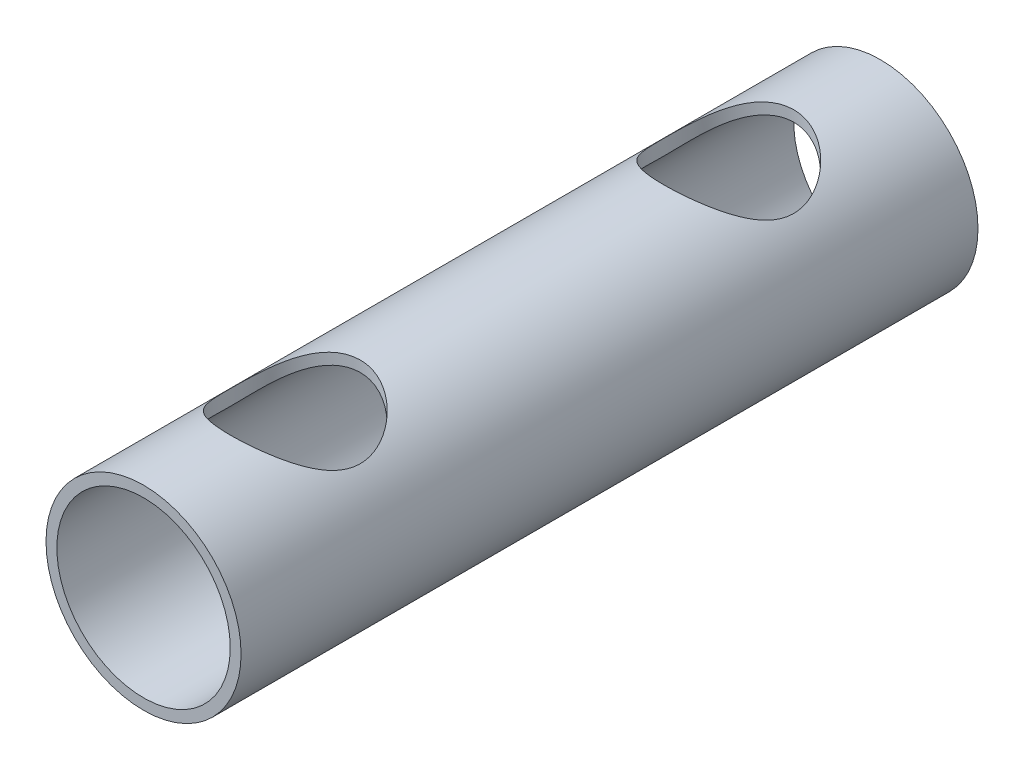
from build123d import *

# Parameters (mm, degrees)
SKETCH1_R           = 57.15
SKETCH1_R_2         = 50.8
BOSS_EXTRUDE1_DEPTH = 431.8
SKETCH2_R           = 38.1
CUT_EXTRUDE4_DEPTH  = 914.4


with BuildPart() as part:
    # Sketch1 → Boss-Extrude1 (new body)
    with BuildSketch(Plane.XY):
        Circle(SKETCH1_R)
        Circle(SKETCH1_R_2, mode=Mode.SUBTRACT)
    extrude(amount=BOSS_EXTRUDE1_DEPTH)

    # Sketch2 → Cut-Extrude4 (cut)
    with BuildSketch(Plane(origin=(0, 0, 0), x_dir=(1, 0, 0), z_dir=(0, 1, 0))):
        with Locations(Location((0, -88.9, 0), (0, 0, 90))):
            Circle(SKETCH2_R)
        with Locations(Location((0, -342.9, 0), (0, 0, 90))):
            Circle(SKETCH2_R)
        with Locations((0, -596.9)):
            Circle(SKETCH2_R)
    extrude(amount=CUT_EXTRUDE4_DEPTH, mode=Mode.SUBTRACT)


solid = part.part
